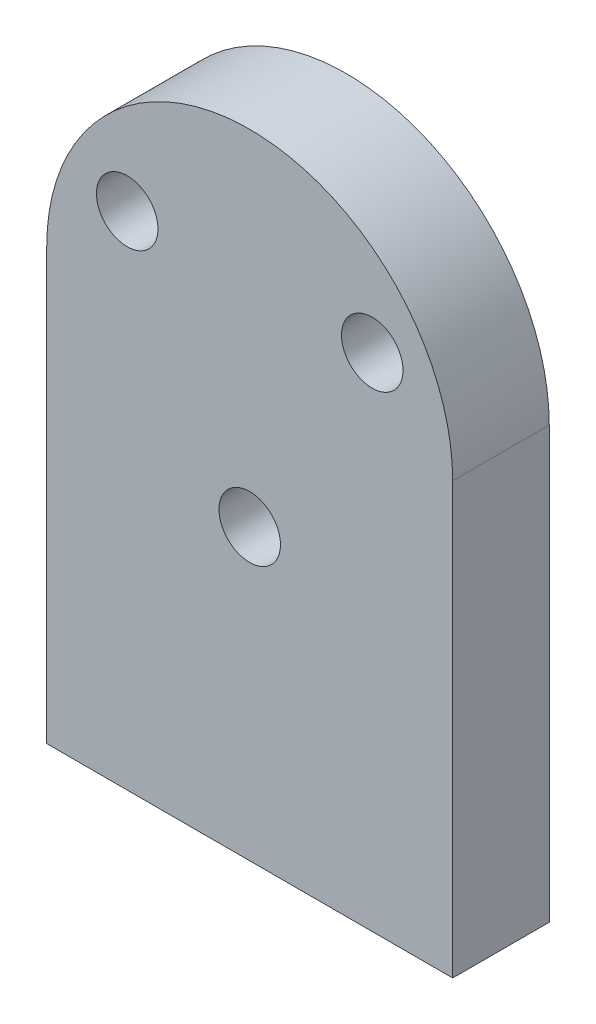
from build123d import *

# Parameters (mm, degrees)
SKETCH1_R           = 0.5
BOSS_EXTRUDE1_DEPTH = 1.57


with BuildPart() as part:
    # Sketch1 → Boss-Extrude1 (new body)
    with BuildSketch(Plane.XY):
        with BuildLine():
            Line((3.3, 0), (3.3, -7))
            Line((3.3, -7), (-3.3, -7))
            Line((-3.3, -7), (-3.3, 0))
            ThreePointArc((-3.3, 0), (0, 3.3), (3.3, 0))
        make_face()
        with Locations((0, -2.3)):
            Circle(SKETCH1_R, mode=Mode.SUBTRACT)
        with Locations((-1.991858429, 1.15)):
            Circle(SKETCH1_R, mode=Mode.SUBTRACT)
        with Locations((1.991858429, 1.15)):
            Circle(SKETCH1_R, mode=Mode.SUBTRACT)
    extrude(amount=BOSS_EXTRUDE1_DEPTH)


solid = part.part
